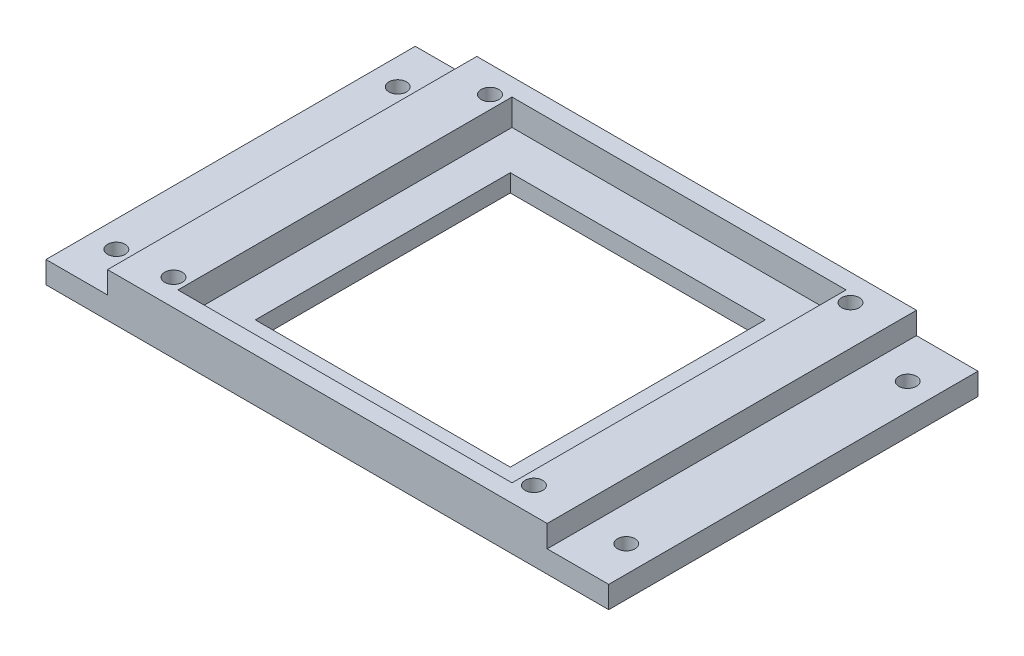
from build123d import *

# Parameters (mm, degrees)
SKETCH1_R            = 11
SKETCH1_R_2          = 7.5
EXTRUDE_THIN1_DEPTH  = 10
BOSS_EXTRUDE2_DEPTH  = 10
SKETCH6_W            = 10
SKETCH6_H            = 5
BOSS_EXTRUDE3_DEPTH  = 10
SKETCH8_W            = 10
SKETCH8_H            = 5
BOSS_EXTRUDE4_DEPTH  = 10
SKETCH9_W            = 42
SKETCH9_H            = 5
BOSS_EXTRUDE5_DEPTH  = 54
SKETCH19_W           = 38
SKETCH19_H           = 38
CUT_EXTRUDE3_DEPTH   = 3
SKETCH25_W           = 29
SKETCH25_H           = 29
CUT_EXTRUDE4_DEPTH   = 2
SKETCH26_R           = 1.00264766
CUT_EXTRUDE5_DEPTH   = 3
LPATTERN4_COUNT      = 2
LPATTERN4_PITCH      = 36
LPATTERN4_COUNT_DIR2 = 2
LPATTERN4_PITCH_DIR2 = 41
SKETCH29_W           = 22
SKETCH29_H           = 36
CUT_EXTRUDE8_DEPTH   = 10
SKETCH35_R           = 1
CUT_EXTRUDE9_DEPTH   = 5
LPATTERN5_COUNT      = 2
LPATTERN5_PITCH      = 58
LPATTERN5_COUNT_DIR2 = 2
LPATTERN5_PITCH_DIR2 = 32
SKETCH37_W           = 42
SKETCH37_H           = 2.5
CUT_EXTRUDE10_DEPTH  = 5
SKETCH38_W           = 42
SKETCH38_H           = 2.5
CUT_EXTRUDE11_DEPTH  = 5
SKETCH39_W           = 1.998284703
SKETCH39_H           = 42
CUT_EXTRUDE12_DEPTH  = 2.5
SKETCH41_W           = 1.997921913
SKETCH41_H           = 42
CUT_EXTRUDE13_DEPTH  = 2.5


with BuildPart() as part:
    # Sketch1 → Extrude-Thin1 (new body)
    with BuildSketch(Plane(origin=(0, 0, 0), x_dir=(0, 0, -1), z_dir=(1, 0, 0))):
        Circle(SKETCH1_R)
        Circle(SKETCH1_R_2, mode=Mode.SUBTRACT)
    extrude(amount=EXTRUDE_THIN1_DEPTH)

    # Sketch3 → Boss-Extrude2 (add)
    with BuildSketch(Plane(origin=(0, 0, 0), x_dir=(0, 0, -1), z_dir=(1, 0, 0))):
        with BuildLine():
            Line((-11, 0), (-11, 30))
            Line((-11, 30), (11, 30))
            Line((11, 30), (11, 0))
            ThreePointArc((11, 0), (0, 11), (-11, 0))
        make_face()
    extrude(amount=BOSS_EXTRUDE2_DEPTH)

    # Sketch6 → Boss-Extrude3 (add)
    with BuildSketch(Plane.XY.offset(11)):
        with Locations((5, 27.5)):
            Rectangle(SKETCH6_W, SKETCH6_H)
    extrude(amount=BOSS_EXTRUDE3_DEPTH)

    # Sketch8 → Boss-Extrude4 (add)
    with BuildSketch(Plane(origin=(0, 0, -11), x_dir=(-1, 0, 0), z_dir=(0, 0, -1))):
        with Locations((-5, 27.5)):
            Rectangle(SKETCH8_W, SKETCH8_H)
    extrude(amount=BOSS_EXTRUDE4_DEPTH)

    # Sketch9 → Boss-Extrude5 (add)
    with BuildSketch(Plane.ZY):
        with Locations((0, 27.5)):
            Rectangle(SKETCH9_W, SKETCH9_H)
    extrude(amount=BOSS_EXTRUDE5_DEPTH)

    # Sketch19 → Cut-Extrude3 (cut)
    with BuildSketch(Plane(origin=(0, 30, 0), x_dir=(1, 0, 0), z_dir=(0, 1, 0))):
        with Locations((-22, 0)):
            Rectangle(SKETCH19_W, SKETCH19_H)
    extrude(amount=-CUT_EXTRUDE3_DEPTH, mode=Mode.SUBTRACT)

    # Sketch25 → Cut-Extrude4 (cut)
    with BuildSketch(Plane(origin=(0, 27, 0), x_dir=(1, 0, 0), z_dir=(0, 1, 0))):
        with Locations((-22.144950272, -0.049169749)):
            Rectangle(SKETCH25_W, SKETCH25_H)
    extrude(amount=-CUT_EXTRUDE4_DEPTH, mode=Mode.SUBTRACT)

    # Sketch26 → Cut-Extrude5 (cut)
    with BuildSketch(Plane(origin=(0, 30, 0), x_dir=(1, 0, 0), z_dir=(0, 1, 0))):
        with Locations(Location((-1.5, 17.99735234, 0), (0, 0, 270))):
            Circle(SKETCH26_R)
    cut_extrude5 = extrude(amount=-CUT_EXTRUDE5_DEPTH, mode=Mode.SUBTRACT)

    # LPattern4: Cut-Extrude5 2 × 2
    with Locations(*[(-j * LPATTERN4_PITCH_DIR2, 0, i * LPATTERN4_PITCH) for i in range(LPATTERN4_COUNT) for j in range(LPATTERN4_COUNT_DIR2) if (i, j) != (0, 0)]):
        add(cut_extrude5, mode=Mode.SUBTRACT)

    # Sketch29 → Cut-Extrude8 (cut)
    with BuildSketch(Plane(origin=(10, 0, 0), x_dir=(0, 0, -1), z_dir=(1, 0, 0))):
        with Locations((0, 7)):
            Rectangle(SKETCH29_W, SKETCH29_H)
    extrude(amount=-CUT_EXTRUDE8_DEPTH, mode=Mode.SUBTRACT)

    # Sketch35 → Cut-Extrude9 (cut)
    with BuildSketch(Plane(origin=(0, 30, 0), x_dir=(1, 0, 0), z_dir=(0, 1, 0))):
        with Locations(Location((7, 16, 0), (0, 0, 270))):
            Circle(SKETCH35_R)
    cut_extrude9 = extrude(amount=-CUT_EXTRUDE9_DEPTH, mode=Mode.SUBTRACT)

    # LPattern5: Cut-Extrude9 2 × 2
    with Locations(*[(-i * LPATTERN5_PITCH, 0, j * LPATTERN5_PITCH_DIR2) for i in range(LPATTERN5_COUNT) for j in range(LPATTERN5_COUNT_DIR2) if (i, j) != (0, 0)]):
        add(cut_extrude9, mode=Mode.SUBTRACT)

    # Sketch37 → Cut-Extrude10 (cut)
    with BuildSketch(Plane(origin=(10, 0, 0), x_dir=(0, 0, -1), z_dir=(1, 0, 0))):
        with Locations((0, 28.75)):
            Rectangle(SKETCH37_W, SKETCH37_H)
    extrude(amount=-CUT_EXTRUDE10_DEPTH, mode=Mode.SUBTRACT)

    # Sketch38 → Cut-Extrude11 (cut)
    with BuildSketch(Plane.ZY.offset(54)):
        with Locations((0, 28.75)):
            Rectangle(SKETCH38_W, SKETCH38_H)
    extrude(amount=-CUT_EXTRUDE11_DEPTH, mode=Mode.SUBTRACT)

    # Sketch39 → Cut-Extrude12 (cut)
    with BuildSketch(Plane(origin=(0, 30, 0), x_dir=(1, 0, 0), z_dir=(0, 1, 0))):
        with Locations((-48.000857649, 0)):
            Rectangle(SKETCH39_W, SKETCH39_H)
    extrude(amount=-CUT_EXTRUDE12_DEPTH, mode=Mode.SUBTRACT)

    # Sketch41 → Cut-Extrude13 (cut)
    with BuildSketch(Plane(origin=(0, 30, 0), x_dir=(1, 0, 0), z_dir=(0, 1, 0))):
        with Locations((4.001039044, 0)):
            Rectangle(SKETCH41_W, SKETCH41_H)
    extrude(amount=-CUT_EXTRUDE13_DEPTH, mode=Mode.SUBTRACT)


solid = part.part
